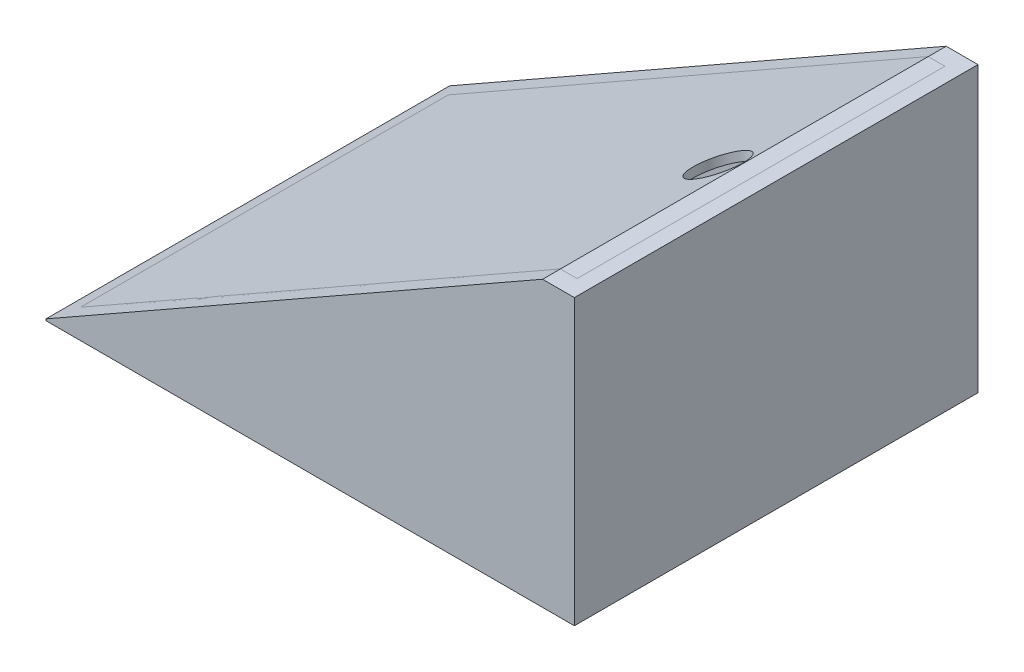
from build123d import *

# Parameters (mm, degrees)
SKETCH1_W               = 115.26232874
SKETCH1_H               = 88.049326178
SKETCH1_W_2             = 108.334990875
SKETCH1_H_2             = 80.232993298
BOSS_EXTRUDE1_DEPTH     = 62
BOSS_EXTRUDE5_DEPTH     = 81
CUT_EXTRUDE1_DEPTH      = 140
CUT_EXTRUDE1_DEPTH_BACK = 140
SKETCH4_R               = 5.428235827
CUT_EXTRUDE2_DEPTH      = 143


with BuildPart() as part:
    # Sketch1 → Boss-Extrude1 (new body)
    with BuildSketch(Plane(origin=(0, 0, 0), x_dir=(1, 0, 0), z_dir=(0, 1, 0))):
        with Locations((11.551784024, -29.311600955)):
            Rectangle(SKETCH1_W, SKETCH1_H)
        with Locations((11.717857977, -29.326880603)):
            Rectangle(SKETCH1_W_2, SKETCH1_H_2, mode=Mode.SUBTRACT)
    extrude(amount=BOSS_EXTRUDE1_DEPTH)

    # Sketch3 → Cut-Extrude1 (cut, two sides: drawn at the far end of the back side and taken through both)
    with BuildSketch(Plane.XY.offset(-10.789616046).offset(-CUT_EXTRUDE1_DEPTH_BACK)):
        Polygon((62.245399556, 62), (-47.988966562, -0.734479554), (-64.593447551, 83.162099854), (74.178741731, 71.645214526), align=None)
    extrude(amount=CUT_EXTRUDE1_DEPTH + CUT_EXTRUDE1_DEPTH_BACK, mode=Mode.SUBTRACT)


with BuildPart() as body_2:
    # Sketch2 → Boss-Extrude5 (new body)
    with BuildSketch(Plane.XY.offset(-10.789616046)):
        Polygon((-42.44963746, 0), (65.885353415, 62), (62.245399556, 62), (-42.44963746, 2.417957753), align=None)
    extrude(amount=BOSS_EXTRUDE5_DEPTH)

    # Sketch4 → Cut-Extrude2 (cut)
    with BuildSketch(Plane(origin=(0, 0, 0), x_dir=(1, 0, 0), z_dir=(0, 1, 0))):
        with Locations(Location((56.50436197, -29.326880603, 0), (0, 0, 180))):
            Circle(SKETCH4_R)
    extrude(amount=CUT_EXTRUDE2_DEPTH, mode=Mode.SUBTRACT)


solid = Compound([part.part, body_2.part])
